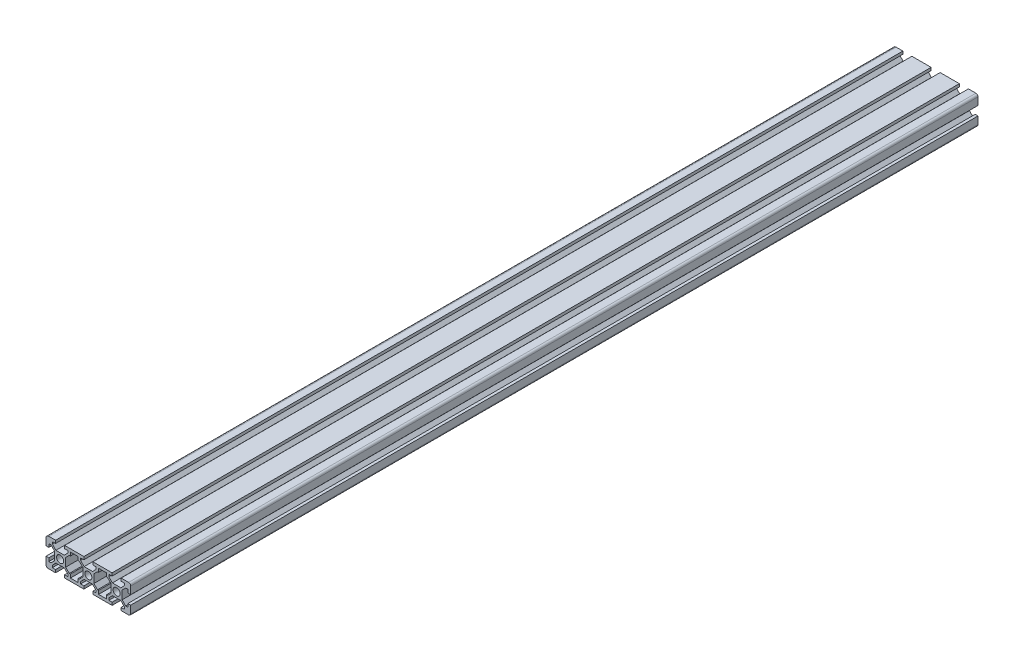
from build123d import *

# Parameters (mm, degrees)
SKETCH_1_R      = 2.5
EXTRUDE_2_DEPTH = 600


with BuildPart() as part:
    # 草图1 → 凸台-拉伸2 (new body)
    with BuildSketch(Plane.XY):
        with BuildLine():
            Line((-23.2, 10), (-28, 10))
            ThreePointArc((-28, 10), (-29.414213562, 9.414213562), (-30, 8))
            Line((-30, 8), (-30, 3.2))
            Line((-30, 3.2), (-28, 3.2))
            Line((-28, 3.2), (-28, 5.5))
            Line((-28, 5.5), (-26.5, 5.5))
            Line((-26.5, 5.5), (-23.9, 3))
            Line((-23.9, 3), (-23.9, -3))
            Line((-23.9, -3), (-26.5, -5.5))
            Line((-26.5, -5.5), (-28, -5.5))
            Line((-28, -5.5), (-28, -3.2))
            Line((-28, -3.2), (-30, -3.2))
            Line((-30, -3.2), (-30, -8.5))
            ThreePointArc((-30, -8.5), (-29.560660172, -9.560660172), (-28.5, -10))
            Line((-28.5, -10), (-23.2, -10))
            Line((-23.2, -10), (-23.2, -8))
            Line((-23.2, -8), (-25.5, -8))
            Line((-25.5, -8), (-25.5, -6.5))
            Line((-25.5, -6.5), (-23, -3.9))
            Line((-23, -3.9), (-17, -3.9))
            Line((-17, -3.9), (-14.5, -6.5))
            Line((-14.5, -6.5), (-14.5, -8))
            Line((-14.5, -8), (-16.8, -8))
            Line((-16.8, -8), (-16.8, -10))
            Line((-16.8, -10), (-3.2, -10))
            Line((-3.2, -10), (-3.2, -8))
            Line((-3.2, -8), (-5.5, -8))
            Line((-5.5, -8), (-5.5, -6.5))
            Line((-5.5, -6.5), (-3, -3.9))
            Line((-3, -3.9), (3, -3.9))
            Line((3, -3.9), (5.5, -6.5))
            Line((5.5, -6.5), (5.5, -8))
            Line((5.5, -8), (3.2, -8))
            Line((3.2, -8), (3.2, -10))
            Line((3.2, -10), (16.8, -10))
            Line((16.8, -10), (16.8, -8))
            Line((16.8, -8), (14.5, -8))
            Line((14.5, -8), (14.5, -6.5))
            Line((14.5, -6.5), (17, -3.9))
            Line((17, -3.9), (23, -3.9))
            Line((23, -3.9), (25.5, -6.5))
            Line((25.5, -6.5), (25.5, -8))
            Line((25.5, -8), (23.2, -8))
            Line((23.2, -8), (23.2, -10))
            Line((23.2, -10), (28.5, -10))
            ThreePointArc((28.5, -10), (29.560660172, -9.560660172), (30, -8.5))
            Line((30, -8.5), (30, -3.2))
            Line((30, -3.2), (28, -3.2))
            Line((28, -3.2), (28, -5.5))
            Line((28, -5.5), (26.5, -5.5))
            Line((26.5, -5.5), (23.9, -3))
            Line((23.9, -3), (23.9, 3))
            Line((23.9, 3), (26.5, 5.5))
            Line((26.5, 5.5), (28, 5.5))
            Line((28, 5.5), (28, 3.2))
            Line((28, 3.2), (30, 3.2))
            Line((30, 3.2), (30, 8.5))
            ThreePointArc((30, 8.5), (29.560660172, 9.560660172), (28.5, 10))
            Line((28.5, 10), (23.2, 10))
            Line((23.2, 10), (23.2, 8))
            Line((23.2, 8), (25.5, 8))
            Line((25.5, 8), (25.5, 6.5))
            Line((25.5, 6.5), (23, 3.9))
            Line((23, 3.9), (17, 3.9))
            Line((17, 3.9), (14.5, 6.5))
            Line((14.5, 6.5), (14.5, 8))
            Line((14.5, 8), (16.8, 8))
            Line((16.8, 8), (16.8, 10))
            Line((16.8, 10), (3.2, 10))
            Line((3.2, 10), (3.2, 8))
            Line((3.2, 8), (5.5, 8))
            Line((5.5, 8), (5.5, 6.5))
            Line((5.5, 6.5), (3, 3.9))
            Line((3, 3.9), (-3, 3.9))
            Line((-3, 3.9), (-5.5, 6.5))
            Line((-5.5, 6.5), (-5.5, 8))
            Line((-5.5, 8), (-3.2, 8))
            Line((-3.2, 8), (-3.2, 10))
            Line((-3.2, 10), (-16.8, 10))
            Line((-16.8, 10), (-16.8, 8))
            Line((-16.8, 8), (-14.5, 8))
            Line((-14.5, 8), (-14.5, 6.5))
            Line((-14.5, 6.5), (-17, 3.9))
            Line((-17, 3.9), (-23, 3.9))
            Line((-23, 3.9), (-25.5, 6.5))
            Line((-25.5, 6.5), (-25.5, 8))
            Line((-25.5, 8), (-23.2, 8))
            Line((-23.2, 8), (-23.2, 10))
        make_face()
        Polygon((-12.75, -8), (-12.75, -5.5), (-13.5, -5.5), (-16.1, -3), (-16.1, 3), (-13.5, 5.5), (-12.75, 5.5), (-12.75, 8), (-7.25, 8), (-7.25, 5.5), (-6.5, 5.5), (-3.9, 3), (-3.9, -3), (-6.5, -5.5), (-7.25, -5.5), (-7.25, -8), align=None, mode=Mode.SUBTRACT)
        Polygon((6.5, -5.5), (3.9, -3), (3.9, 3), (6.5, 5.5), (7.25, 5.5), (7.25, 8), (12.75, 8), (12.75, 5.5), (13.5, 5.5), (16.1, 3), (16.1, -3), (13.5, -5.5), (12.75, -5.5), (12.75, -8), (7.25, -8), (7.25, -5.5), align=None, mode=Mode.SUBTRACT)
        with Locations((20, 0)):
            Circle(SKETCH_1_R, mode=Mode.SUBTRACT)
        with Locations((-20, 0)):
            Circle(SKETCH_1_R, mode=Mode.SUBTRACT)
        Circle(SKETCH_1_R, mode=Mode.SUBTRACT)
    extrude(amount=EXTRUDE_2_DEPTH)


solid = part.part
